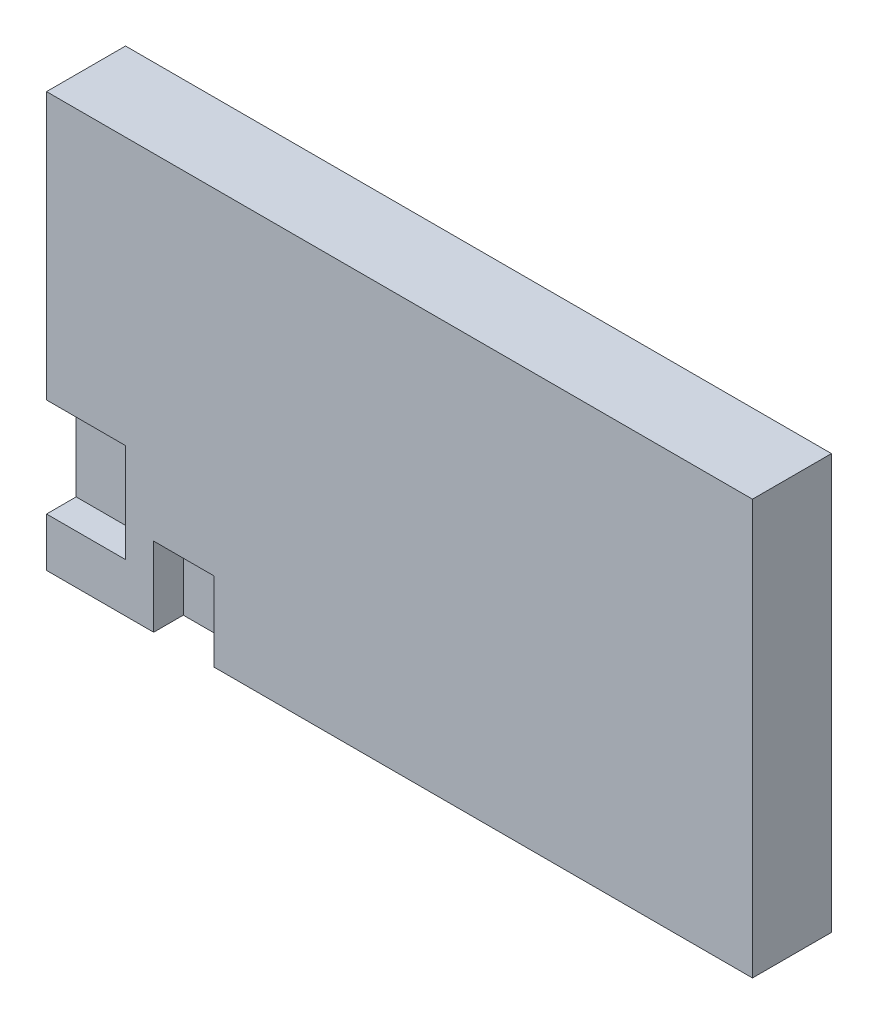
from build123d import *

# Parameters (mm, degrees)
SKETCH_1_W          = 143
SKETCH_1_H          = 84
EXTRUDE_1_DEPTH     = 16
SKETCH_2_W          = 16
SKETCH_2_H          = 20
SKETCH_2_W_2        = 12.2
SKETCH_2_H_2        = 16
CUT_EXTRUDE_1_DEPTH = 6


with BuildPart() as part:
    # 草圖1 → 填料-伸長1 (new body)
    with BuildSketch(Plane.XY):
        with Locations((5.593642939, -13.161971831)):
            Rectangle(SKETCH_1_W, SKETCH_1_H)
    extrude(amount=EXTRUDE_1_DEPTH)

    # 草圖2 → 除料-伸長1 (cut)
    with BuildSketch(Plane.XY.offset(16)):
        with Locations((-57.906357061, -35.261971831)):
            Rectangle(SKETCH_2_W, SKETCH_2_H)
        with Locations((-38.106357061, -47.161971831)):
            Rectangle(SKETCH_2_W_2, SKETCH_2_H_2)
    extrude(amount=-CUT_EXTRUDE_1_DEPTH, mode=Mode.SUBTRACT)


solid = part.part
